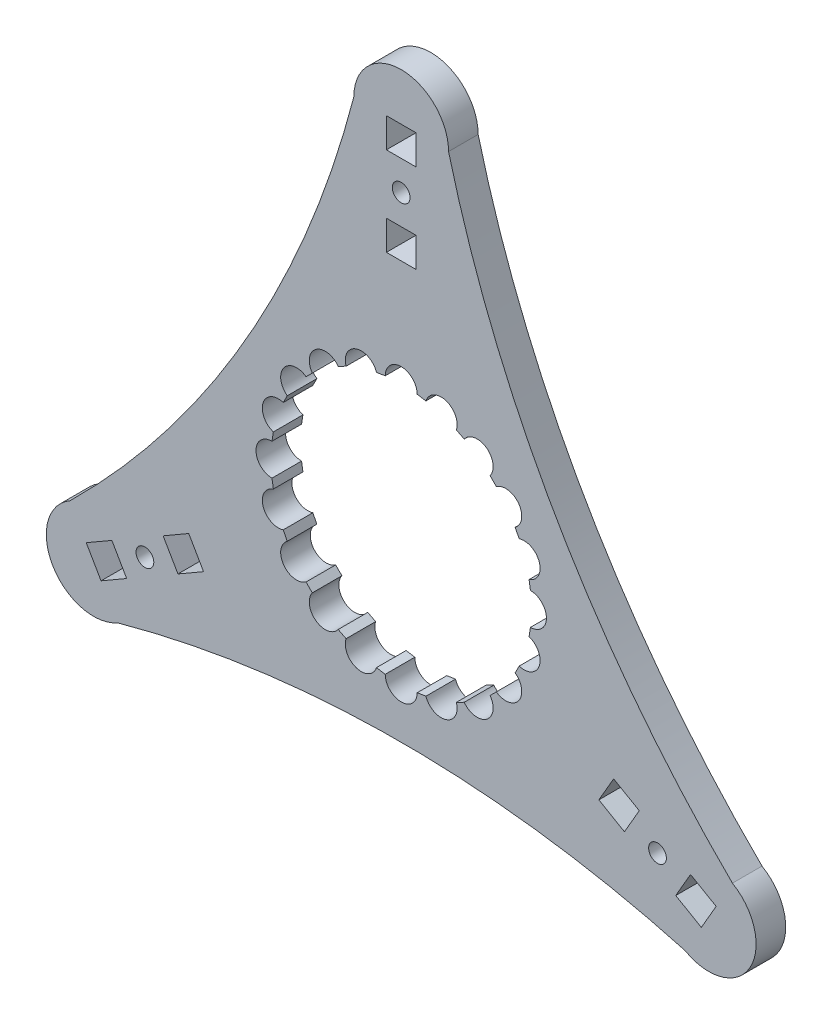
from build123d import *

# Parameters (mm, degrees)
ESQUISSE1_R        = 1.5
ESQUISSE1_W        = 5
ESQUISSE1_H        = 5
BOSS_EXTRU_1_DEPTH = 5


with BuildPart() as part:
    # Esquisse1 → Boss.-Extru.1 (new body)
    with BuildSketch(Plane.XY):
        with BuildLine():
            ThreePointArc((-55.961524227, -23.07179677), (-58.889727457, -34), (-47.961524227, -36.92820323))
            ThreePointArc((-47.961524227, -36.92820323), (0, -30.420831874), (47.961524227, -36.92820323))
            ThreePointArc((47.961524227, -36.92820323), (58.889727457, -34), (55.961524227, -23.07179677))
            ThreePointArc((55.961524227, -23.07179677), (26.345213207, 15.210415937), (8, 60))
            ThreePointArc((8, 60), (0, 68), (-8, 60))
            ThreePointArc((-8, 60), (-26.345213207, 15.210415937), (-55.961524227, -23.07179677))
        make_face()
        with Locations((43.301270189, -25)):
            Circle(ESQUISSE1_R, mode=Mode.SUBTRACT)
        with Locations((0, 50)):
            Circle(ESQUISSE1_R, mode=Mode.SUBTRACT)
        with Locations((-43.301270189, -25)):
            Circle(ESQUISSE1_R, mode=Mode.SUBTRACT)
        with BuildLine():
            Line((2.7, 21.833689565), (4.179128531, 21.59941862))
            ThreePointArc((4.179128531, 21.59941862), (7.58132701, 23.332925329), (9.314833719, 19.93072685))
            Line((9.314833719, 19.93072685), (10.649174844, 19.250846089))
            ThreePointArc((10.649174844, 19.250846089), (14.42054091, 19.848171792), (15.017866614, 16.076805726))
            Line((15.017866614, 16.076805726), (16.076805726, 15.017866614))
            ThreePointArc((16.076805726, 15.017866614), (19.848171792, 14.42054091), (19.250846089, 10.649174844))
            Line((19.250846089, 10.649174844), (19.93072685, 9.314833719))
            ThreePointArc((19.93072685, 9.314833719), (23.332925329, 7.58132701), (21.59941862, 4.179128531))
            Line((21.59941862, 4.179128531), (21.833689565, 2.7))
            ThreePointArc((21.833689565, 2.7), (24.533689565, 0), (21.833689565, -2.7))
            Line((21.833689565, -2.7), (21.59941862, -4.179128531))
            ThreePointArc((21.59941862, -4.179128531), (23.332925329, -7.58132701), (19.93072685, -9.314833719))
            Line((19.93072685, -9.314833719), (19.250846089, -10.649174844))
            ThreePointArc((19.250846089, -10.649174844), (19.848171792, -14.42054091), (16.076805726, -15.017866614))
            Line((16.076805726, -15.017866614), (15.017866614, -16.076805726))
            ThreePointArc((15.017866614, -16.076805726), (14.42054091, -19.848171792), (10.649174844, -19.250846089))
            Line((10.649174844, -19.250846089), (9.314833719, -19.93072685))
            ThreePointArc((9.314833719, -19.93072685), (7.58132701, -23.332925329), (4.179128531, -21.59941862))
            Line((4.179128531, -21.59941862), (2.7, -21.833689565))
            ThreePointArc((2.7, -21.833689565), (0, -24.533689565), (-2.7, -21.833689565))
            Line((-2.7, -21.833689565), (-4.179128531, -21.59941862))
            ThreePointArc((-4.179128531, -21.59941862), (-7.58132701, -23.332925329), (-9.314833719, -19.93072685))
            Line((-9.314833719, -19.93072685), (-10.649174844, -19.250846089))
            ThreePointArc((-10.649174844, -19.250846089), (-14.42054091, -19.848171792), (-15.017866614, -16.076805726))
            Line((-15.017866614, -16.076805726), (-16.076805726, -15.017866614))
            ThreePointArc((-16.076805726, -15.017866614), (-19.848171792, -14.42054091), (-19.250846089, -10.649174844))
            Line((-19.250846089, -10.649174844), (-19.93072685, -9.314833719))
            ThreePointArc((-19.93072685, -9.314833719), (-23.332925329, -7.58132701), (-21.59941862, -4.179128531))
            Line((-21.59941862, -4.179128531), (-21.833689565, -2.7))
            ThreePointArc((-21.833689565, -2.7), (-24.533689565, 0), (-21.833689565, 2.7))
            Line((-21.833689565, 2.7), (-21.59941862, 4.179128531))
            ThreePointArc((-21.59941862, 4.179128531), (-23.332925329, 7.58132701), (-19.93072685, 9.314833719))
            Line((-19.93072685, 9.314833719), (-19.250846089, 10.649174844))
            ThreePointArc((-19.250846089, 10.649174844), (-19.848171792, 14.42054091), (-16.076805726, 15.017866614))
            Line((-16.076805726, 15.017866614), (-15.017866614, 16.076805726))
            ThreePointArc((-15.017866614, 16.076805726), (-14.42054091, 19.848171792), (-10.649174844, 19.250846089))
            Line((-10.649174844, 19.250846089), (-9.314833719, 19.93072685))
            ThreePointArc((-9.314833719, 19.93072685), (-7.58132701, 23.332925329), (-4.179128531, 21.59941862))
            Line((-4.179128531, 21.59941862), (-2.7, 21.833689565))
            ThreePointArc((-2.7, 21.833689565), (0, 24.533689565), (2.7, 21.833689565))
        make_face(mode=Mode.SUBTRACT)
        Polygon((40.22114317, -20.334936491), (35.891016151, -17.834936491), (33.391016151, -22.165063509), (37.72114317, -24.665063509), align=None, mode=Mode.SUBTRACT)
        Polygon((48.881397208, -25.334936491), (53.211524227, -27.834936491), (50.711524227, -32.165063509), (46.381397208, -29.665063509), align=None, mode=Mode.SUBTRACT)
        with Locations((0, 57.5)):
            Rectangle(ESQUISSE1_W, ESQUISSE1_H, mode=Mode.SUBTRACT)
        with Locations((0, 42.5)):
            Rectangle(ESQUISSE1_W, ESQUISSE1_H, mode=Mode.SUBTRACT)
        Polygon((-48.881397208, -25.334936491), (-53.211524227, -27.834936491), (-50.711524227, -32.165063509), (-46.381397208, -29.665063509), align=None, mode=Mode.SUBTRACT)
        Polygon((-40.22114317, -20.334936491), (-35.891016151, -17.834936491), (-33.391016151, -22.165063509), (-37.72114317, -24.665063509), align=None, mode=Mode.SUBTRACT)
    extrude(amount=BOSS_EXTRU_1_DEPTH)


solid = part.part
